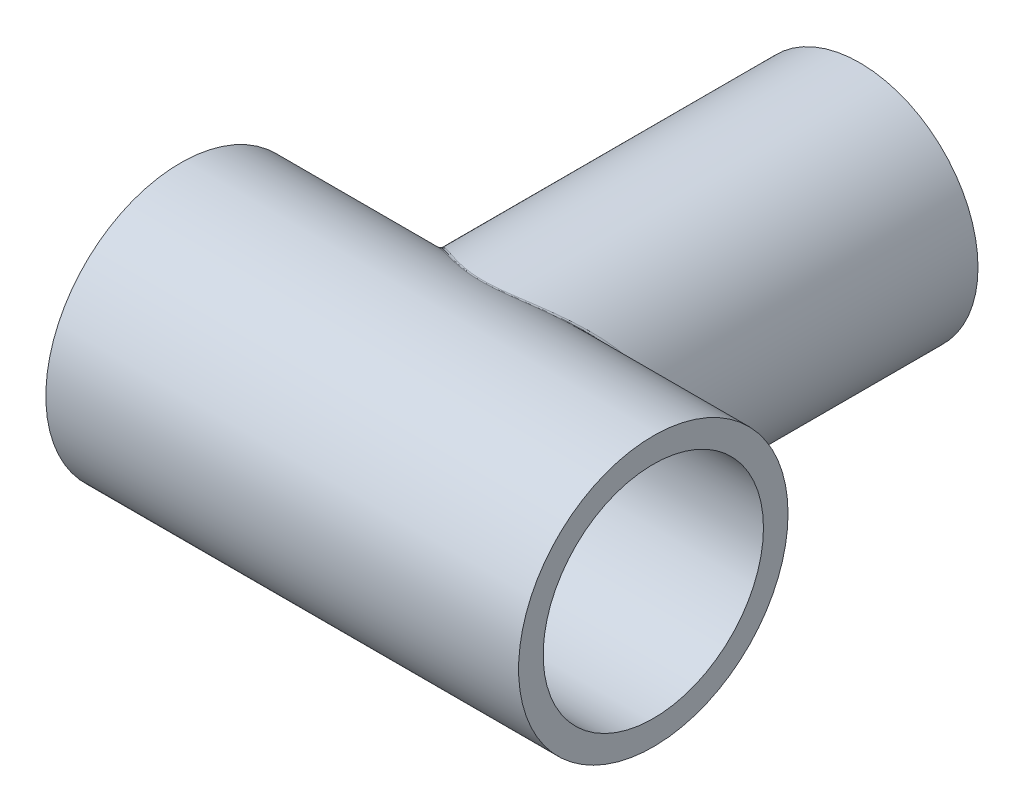
from build123d import *

# Parameters (mm, degrees)
SKETCH1_R           = 25
SKETCH1_R_2         = 20
BOSS_EXTRUDE1_DEPTH = 80
SKETCH2_R           = 28.5
SKETCH2_R_2         = 23.3
BOSS_EXTRUDE2_DEPTH = 50
SKETCH2_2_R         = 23.3
CUT_EXTRUDE1_DEPTH  = 30
FILLET1_R           = 1


with BuildPart() as part:
    # Sketch1 → Boss-Extrude1 (new body)
    with BuildSketch(Plane.XY):
        Circle(SKETCH1_R)
        Circle(SKETCH1_R_2, mode=Mode.SUBTRACT)
    extrude(amount=BOSS_EXTRUDE1_DEPTH)

    # Sketch2 → Boss-Extrude2 (add, symmetric)
    with BuildSketch(Plane(origin=(0, 0, 0), x_dir=(0, 0, -1), z_dir=(1, 0, 0))):
        with Locations((-93.683932183, 0)):
            Circle(SKETCH2_R)
        with Locations((-93.683932183, 0)):
            Circle(SKETCH2_R_2, mode=Mode.SUBTRACT)
    extrude(amount=BOSS_EXTRUDE2_DEPTH, both=True)

    # Sketch2<2> → Cut-Extrude1 (cut, symmetric)
    with BuildSketch(Plane(origin=(0, 0, 0), x_dir=(0, 0, -1), z_dir=(1, 0, 0))):
        with Locations((-93.683932183, 0)):
            Circle(SKETCH2_2_R)
    extrude(amount=CUT_EXTRUDE1_DEPTH, both=True, mode=Mode.SUBTRACT)

    # Fillet1
    fillet1_edges = [part.edges().sort_by_distance(p)[0] for p in [
        (0, 25, 80),
    ]]
    fillet(fillet1_edges, radius=FILLET1_R)


solid = part.part
